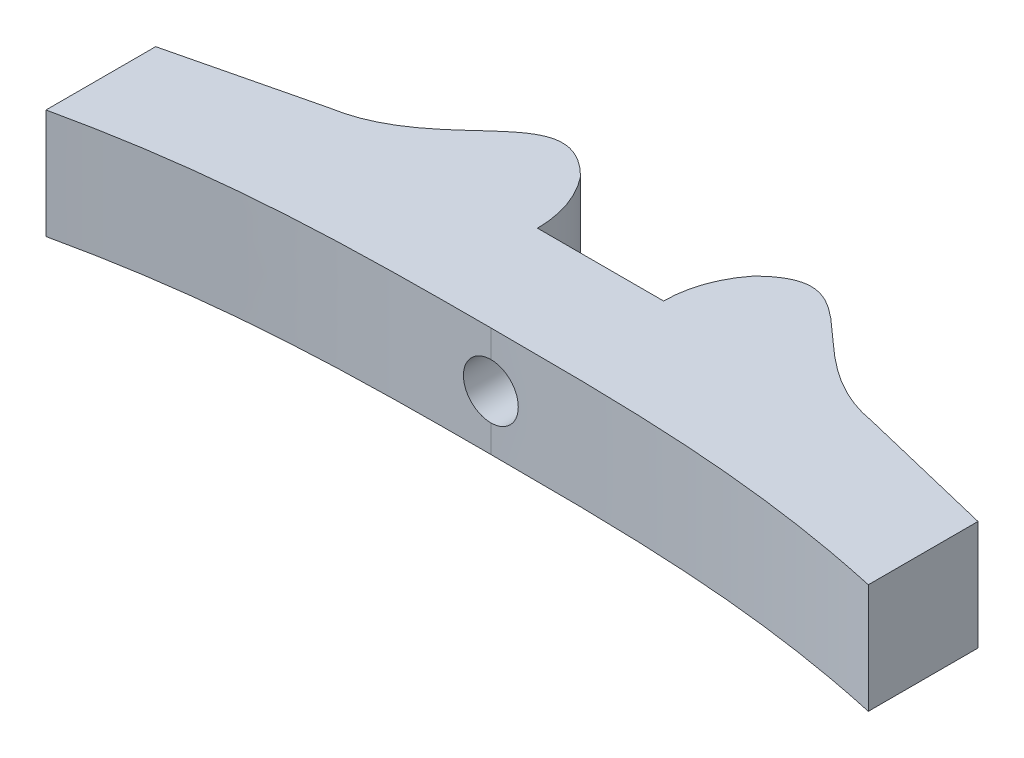
from build123d import *

# Parameters (mm, degrees)
BOSS_EXTRUDE1_DEPTH = 5.08
SKETCH2_R           = 1.27
CUT_EXTRUDE1_DEPTH  = 21.804373065


with BuildPart() as part:
    # Sketch1 → Boss-Extrude1 (new body)
    with BuildSketch(Plane(origin=(0, 0, 0), x_dir=(1, 0, 0), z_dir=(0, 1, 0))):
        with BuildLine():
            Line((-2.921, 0), (2.921, 0))
            ThreePointArc((2.921, 0), (3.194769584, 1.619600019), (3.985657936, 3.059235259))
            add(Edge.make_bspline(
                [(3.985657936, 3.059235259), (7.051058423, 6.139247021), (8.049104097, 0.757810136), (12.59205, 0)],
                knots=[0, 0, 0, 0, 1, 1, 1, 1], degree=3))
            Line((12.59205, 0), (19.05, -1.561764261))
            Line((19.05, -1.561764261), (19.05, -6.641764261))
            add(Edge.make_bspline(
                [(0, -5.08), (6.487990647, -5.08), (12.210887545, -5.133294781), (19.05, -6.641764261)],
                knots=[0, 0, 0, 0, 1, 1, 1, 1], degree=3))
            add(Edge.make_bspline(
                [(0, -5.08), (-6.487990647, -5.08), (-12.210887545, -5.133294781), (-19.05, -6.641764261)],
                knots=[0, 0, 0, 0, 1, 1, 1, 1], degree=3))
            Line((-19.05, -6.641764261), (-19.05, -1.561764261))
            Line((-19.05, -1.561764261), (-12.59205, 0))
            add(Edge.make_bspline(
                [(-3.985657936, 3.059235259), (-7.051058423, 6.139247021), (-8.049104097, 0.757810136), (-12.59205, 0)],
                knots=[0, 0, 0, 0, 1, 1, 1, 1], degree=3))
            ThreePointArc((-3.985657936, 3.059235259), (-3.194769584, 1.619600019), (-2.921, 0))
        make_face()
    extrude(amount=BOSS_EXTRUDE1_DEPTH)

    # Sketch2 → Cut-Extrude1 (cut, through all)
    with BuildSketch(Plane(origin=(0, 0, 0), x_dir=(-1, 0, 0), z_dir=(0, 0, -1))):
        with Locations((0, 2.54)):
            Circle(SKETCH2_R)
    extrude(amount=-CUT_EXTRUDE1_DEPTH, mode=Mode.SUBTRACT)


solid = part.part
